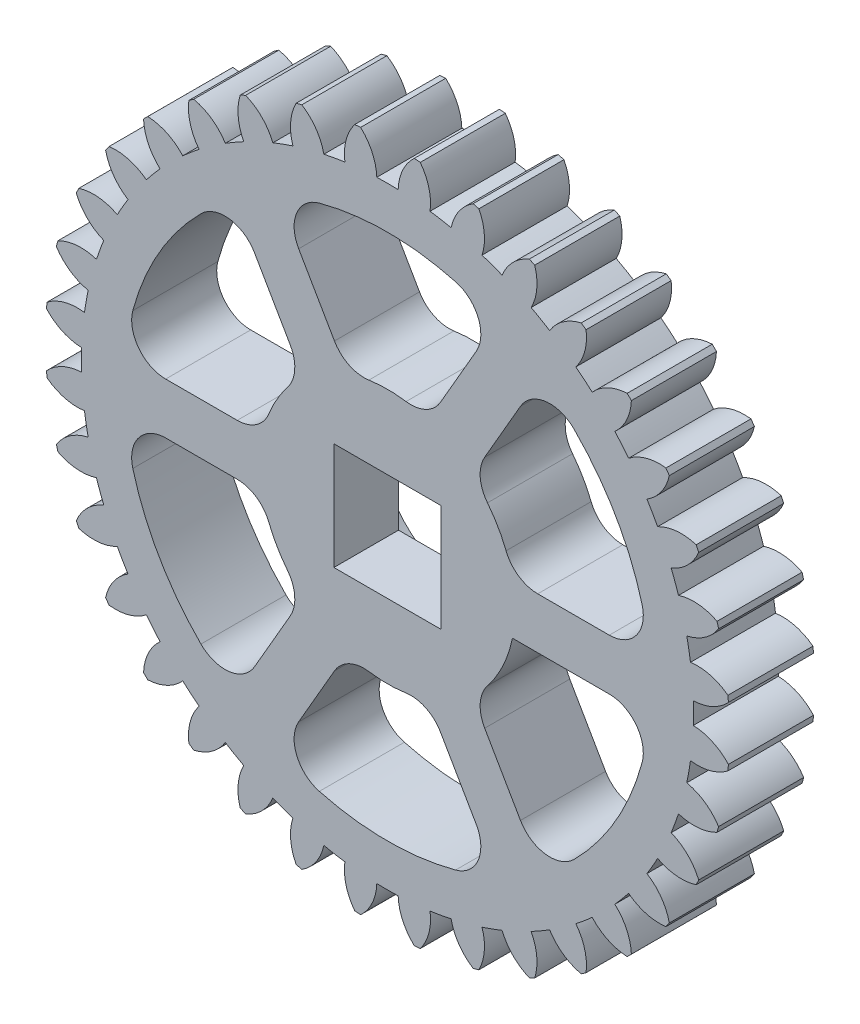
from build123d import *

# Parameters (mm, degrees)
BOSS_EXTRUDE1_DEPTH = 5
SKETCH2_W           = 6.3
SKETCH2_H           = 6.3
CUT_EXTRUDE1_DEPTH  = 5
SKETCH2_3_R         = 5.5
SKETCH2_3_W         = 6.3
SKETCH2_3_H         = 6.3
CUT_EXTRUDE2_DEPTH  = 1.2
CUT_EXTRUDE3_REACH  = 30.781
FILLET1_R           = 2


with BuildPart() as part:
    # Sketch1 → Boss-Extrude1 (new body)
    with BuildSketch(Plane.XY):
        with BuildLine():
            ThreePointArc((-19.372922994, 5.372587037), (-19.419069404, 5.203323965), (-19.463736977, 5.03366464))
            ThreePointArc((-19.463736977, 5.03366464), (-18.658088573, 4.199038956), (-17.592962747, 3.739499671))
            ThreePointArc((-17.592962747, 3.739499671), (-17.712752246, 3.123236124), (-17.810961484, 2.503167394))
            ThreePointArc((-17.810961484, 2.503167394), (-18.969024056, 2.435636207), (-20.011544712, 1.926892593))
            ThreePointArc((-20.011544712, 1.926892593), (-20.02759783, 1.752187768), (-20.042125769, 1.577349506))
            ThreePointArc((-20.042125769, 1.577349506), (-19.103785746, 0.89530304), (-17.975043415, 0.627702348))
            ThreePointArc((-17.975043415, 0.627702348), (-17.983260645, 0.313898982), (-17.986, 0))
            ThreePointArc((-17.986, 0), (-17.983260645, -0.313898982), (-17.975043415, -0.627702348))
            ThreePointArc((-17.975043415, -0.627702348), (-19.103785746, -0.89530304), (-20.042125769, -1.577349506))
            ThreePointArc((-20.042125769, -1.577349506), (-20.02759783, -1.752187768), (-20.011544712, -1.926892593))
            ThreePointArc((-20.011544712, -1.926892593), (-18.969024056, -2.435636207), (-17.810961484, -2.503167394))
            ThreePointArc((-17.810961484, -2.503167394), (-17.712752246, -3.123236124), (-17.592962747, -3.739499671))
            ThreePointArc((-17.592962747, -3.739499671), (-18.658088573, -4.199038956), (-19.463736977, -5.03366464))
            ThreePointArc((-19.463736977, -5.03366464), (-19.419069404, -5.203323965), (-19.372922994, -5.372587037))
            ThreePointArc((-19.372922994, -5.372587037), (-18.257898169, -5.692569879), (-17.105702502, -5.557979661))
            ThreePointArc((-17.105702502, -5.557979661), (-16.901311477, -6.151574298), (-16.676328808, -6.737674189))
            ThreePointArc((-16.676328808, -6.737674189), (-17.645474821, -7.375189199), (-18.293952386, -8.33703442))
            ThreePointArc((-18.293952386, -8.33703442), (-18.220502381, -8.496359796), (-18.145664815, -8.655038141))
            ThreePointArc((-18.145664815, -8.655038141), (-16.992015285, -8.776537697), (-15.880695405, -8.443915528))
            ThreePointArc((-15.880695405, -8.443915528), (-15.576332912, -8.993), (-15.252993057, -9.531127886))
            ThreePointArc((-15.252993057, -9.531127886), (-16.096712245, -10.32724805), (-16.568315309, -11.387087628))
            ThreePointArc((-16.568315309, -11.387087628), (-16.468314614, -11.531238034), (-16.367059793, -11.674510292))
            ThreePointArc((-16.367059793, -11.674510292), (-15.209838614, -11.593834857), (-14.173161414, -11.073287295))
            ThreePointArc((-14.173161414, -11.073287295), (-13.778075354, -11.561177948), (-13.366202831, -12.034983086))
            ThreePointArc((-13.366202831, -12.034983086), (-14.058859213, -12.965518694), (-14.339258355, -14.09114994))
            ThreePointArc((-14.339258355, -14.09114994), (-14.21574544, -14.21574544), (-14.09114994, -14.339258355))
            ThreePointArc((-14.09114994, -14.339258355), (-12.965518694, -14.058859213), (-12.034983086, -13.366202831))
            ThreePointArc((-12.034983086, -13.366202831), (-11.561177948, -13.778075354), (-11.073287295, -14.173161414))
            ThreePointArc((-11.073287295, -14.173161414), (-11.538005499, -15.029065872), (-11.698749958, -15.989636883))
            ThreePointArc((-11.698749958, -15.989636883), (-11.692683805, -16.17873713), (-11.674510292, -16.367059793))
            ThreePointArc((-11.674510292, -16.367059793), (-11.531238034, -16.468314614), (-11.387087628, -16.568315309))
            ThreePointArc((-11.387087628, -16.568315309), (-10.32724805, -16.096712245), (-9.531127886, -15.252993057))
            ThreePointArc((-9.531127886, -15.252993057), (-8.993, -15.576332912), (-8.443915528, -15.880695405))
            ThreePointArc((-8.443915528, -15.880695405), (-8.701631413, -16.552068237), (-8.789272246, -17.265845542))
            ThreePointArc((-8.789272246, -17.265845542), (-8.755520669, -17.710845752), (-8.655038141, -18.145664815))
            ThreePointArc((-8.655038141, -18.145664815), (-8.496359796, -18.220502381), (-8.33703442, -18.293952386))
            ThreePointArc((-8.33703442, -18.293952386), (-7.375189199, -17.645474821), (-6.737674189, -16.676328808))
            ThreePointArc((-6.737674189, -16.676328808), (-6.151574298, -16.901311477), (-5.557979661, -17.105702502))
            ThreePointArc((-5.557979661, -17.105702502), (-5.666059852, -17.555888899), (-5.702384729, -18.017440222))
            ThreePointArc((-5.702384729, -18.017440222), (-5.618749929, -18.714953674), (-5.372587037, -19.372922994))
            ThreePointArc((-5.372587037, -19.372922994), (-5.203323965, -19.419069404), (-5.03366464, -19.463736977))
            ThreePointArc((-5.03366464, -19.463736977), (-4.199038956, -18.658088573), (-3.739499671, -17.592962747))
            ThreePointArc((-3.739499671, -17.592962747), (-3.123236124, -17.712752246), (-2.503167394, -17.810961484))
            ThreePointArc((-2.503167394, -17.810961484), (-2.524693788, -18.015771442), (-2.531880924, -18.221584097))
            ThreePointArc((-2.531880924, -18.221584097), (-2.376544742, -19.166302294), (-1.926892593, -20.011544712))
            ThreePointArc((-1.926892593, -20.011544712), (-1.752187768, -20.02759783), (-1.577349506, -20.042125769))
            ThreePointArc((-1.577349506, -20.042125769), (-0.89530304, -19.103785746), (-0.627702348, -17.975043415))
            ThreePointArc((-0.627702348, -17.975043415), (0, -17.986), (0.627702348, -17.975043415))
            ThreePointArc((0.627702348, -17.975043415), (0.89530304, -19.103785746), (1.577349506, -20.042125769))
            ThreePointArc((1.577349506, -20.042125769), (1.752187768, -20.02759783), (1.926892593, -20.011544712))
            ThreePointArc((1.926892593, -20.011544712), (2.435636207, -18.969024056), (2.503167394, -17.810961484))
            ThreePointArc((2.503167394, -17.810961484), (3.123236124, -17.712752246), (3.739499671, -17.592962747))
            ThreePointArc((3.739499671, -17.592962747), (4.199038956, -18.658088573), (5.03366464, -19.463736977))
            ThreePointArc((5.03366464, -19.463736977), (5.203323965, -19.419069404), (5.372587037, -19.372922994))
            ThreePointArc((5.372587037, -19.372922994), (5.692569879, -18.257898169), (5.557979661, -17.105702502))
            ThreePointArc((5.557979661, -17.105702502), (6.151574298, -16.901311477), (6.737674189, -16.676328808))
            ThreePointArc((6.737674189, -16.676328808), (7.375189199, -17.645474821), (8.33703442, -18.293952386))
            ThreePointArc((8.33703442, -18.293952386), (8.496359796, -18.220502381), (8.655038141, -18.145664815))
            ThreePointArc((8.655038141, -18.145664815), (8.776537697, -16.992015285), (8.443915528, -15.880695405))
            ThreePointArc((8.443915528, -15.880695405), (8.993, -15.576332912), (9.531127886, -15.252993057))
            ThreePointArc((9.531127886, -15.252993057), (10.32724805, -16.096712245), (11.387087628, -16.568315309))
            ThreePointArc((11.387087628, -16.568315309), (11.531238034, -16.468314614), (11.674510292, -16.367059793))
            ThreePointArc((11.674510292, -16.367059793), (11.593834857, -15.209838614), (11.073287295, -14.173161414))
            ThreePointArc((11.073287295, -14.173161414), (11.561177948, -13.778075354), (12.034983086, -13.366202831))
            ThreePointArc((12.034983086, -13.366202831), (12.965518694, -14.058859213), (14.09114994, -14.339258355))
            ThreePointArc((14.09114994, -14.339258355), (14.21574544, -14.21574544), (14.339258355, -14.09114994))
            ThreePointArc((14.339258355, -14.09114994), (14.058859213, -12.965518694), (13.366202831, -12.034983086))
            ThreePointArc((13.366202831, -12.034983086), (13.778075354, -11.561177948), (14.173161414, -11.073287295))
            ThreePointArc((14.173161414, -11.073287295), (15.209838614, -11.593834857), (16.367059793, -11.674510292))
            ThreePointArc((16.367059793, -11.674510292), (16.468314614, -11.531238034), (16.568315309, -11.387087628))
            ThreePointArc((16.568315309, -11.387087628), (16.096712245, -10.32724805), (15.252993057, -9.531127886))
            ThreePointArc((15.252993057, -9.531127886), (15.576332912, -8.993), (15.880695405, -8.443915528))
            ThreePointArc((15.880695405, -8.443915528), (16.992015285, -8.776537697), (18.145664815, -8.655038141))
            ThreePointArc((18.145664815, -8.655038141), (18.220502381, -8.496359796), (18.293952386, -8.33703442))
            ThreePointArc((18.293952386, -8.33703442), (17.645474821, -7.375189199), (16.676328808, -6.737674189))
            ThreePointArc((16.676328808, -6.737674189), (16.901311477, -6.151574298), (17.105702502, -5.557979661))
            ThreePointArc((17.105702502, -5.557979661), (18.257898169, -5.692569879), (19.372922994, -5.372587037))
            ThreePointArc((19.372922994, -5.372587037), (19.419069404, -5.203323965), (19.463736977, -5.03366464))
            ThreePointArc((19.463736977, -5.03366464), (18.658088573, -4.199038956), (17.592962747, -3.739499671))
            ThreePointArc((17.592962747, -3.739499671), (17.712752246, -3.123236124), (17.810961484, -2.503167394))
            ThreePointArc((17.810961484, -2.503167394), (18.969024056, -2.435636207), (20.011544712, -1.926892593))
            ThreePointArc((20.011544712, -1.926892593), (20.02759783, -1.752187768), (20.042125769, -1.577349506))
            ThreePointArc((20.042125769, -1.577349506), (19.103785746, -0.89530304), (17.975043415, -0.627702348))
            ThreePointArc((17.975043415, -0.627702348), (17.986, 0), (17.975043415, 0.627702348))
            ThreePointArc((17.975043415, 0.627702348), (19.103785746, 0.89530304), (20.042125769, 1.577349506))
            ThreePointArc((20.042125769, 1.577349506), (20.02759783, 1.752187768), (20.011544712, 1.926892593))
            ThreePointArc((20.011544712, 1.926892593), (18.969024056, 2.435636207), (17.810961484, 2.503167394))
            ThreePointArc((17.810961484, 2.503167394), (17.712752246, 3.123236124), (17.592962747, 3.739499671))
            ThreePointArc((17.592962747, 3.739499671), (18.658088573, 4.199038956), (19.463736977, 5.03366464))
            ThreePointArc((19.463736977, 5.03366464), (19.419069404, 5.203323965), (19.372922994, 5.372587037))
            ThreePointArc((19.372922994, 5.372587037), (18.257898169, 5.692569879), (17.105702502, 5.557979661))
            ThreePointArc((17.105702502, 5.557979661), (16.901311477, 6.151574298), (16.676328808, 6.737674189))
            ThreePointArc((16.676328808, 6.737674189), (17.645474821, 7.375189199), (18.293952386, 8.33703442))
            ThreePointArc((18.293952386, 8.33703442), (18.220502381, 8.496359796), (18.145664815, 8.655038141))
            ThreePointArc((18.145664815, 8.655038141), (16.992015285, 8.776537697), (15.880695405, 8.443915528))
            ThreePointArc((15.880695405, 8.443915528), (15.576332912, 8.993), (15.252993057, 9.531127886))
            ThreePointArc((15.252993057, 9.531127886), (16.096712245, 10.32724805), (16.568315309, 11.387087628))
            ThreePointArc((16.568315309, 11.387087628), (16.468314614, 11.531238034), (16.367059793, 11.674510292))
            ThreePointArc((16.367059793, 11.674510292), (15.209838614, 11.593834857), (14.173161414, 11.073287295))
            ThreePointArc((14.173161414, 11.073287295), (13.778075354, 11.561177948), (13.366202831, 12.034983086))
            ThreePointArc((13.366202831, 12.034983086), (14.058859213, 12.965518694), (14.339258355, 14.09114994))
            ThreePointArc((14.339258355, 14.09114994), (14.21574544, 14.21574544), (14.09114994, 14.339258355))
            ThreePointArc((14.09114994, 14.339258355), (12.965518694, 14.058859213), (12.034983086, 13.366202831))
            ThreePointArc((12.034983086, 13.366202831), (11.561177948, 13.778075354), (11.073287295, 14.173161414))
            ThreePointArc((11.073287295, 14.173161414), (11.593834857, 15.209838614), (11.674510292, 16.367059793))
            ThreePointArc((11.674510292, 16.367059793), (11.531238034, 16.468314614), (11.387087628, 16.568315309))
            ThreePointArc((11.387087628, 16.568315309), (10.32724805, 16.096712245), (9.531127886, 15.252993057))
            ThreePointArc((9.531127886, 15.252993057), (8.993, 15.576332912), (8.443915528, 15.880695405))
            ThreePointArc((8.443915528, 15.880695405), (8.776537697, 16.992015285), (8.655038141, 18.145664815))
            ThreePointArc((8.655038141, 18.145664815), (8.496359796, 18.220502381), (8.33703442, 18.293952386))
            ThreePointArc((8.33703442, 18.293952386), (7.375189199, 17.645474821), (6.737674189, 16.676328808))
            ThreePointArc((6.737674189, 16.676328808), (6.151574298, 16.901311477), (5.557979661, 17.105702502))
            ThreePointArc((5.557979661, 17.105702502), (5.692569879, 18.257898169), (5.372587037, 19.372922994))
            ThreePointArc((5.372587037, 19.372922994), (5.203323965, 19.419069404), (5.03366464, 19.463736977))
            ThreePointArc((5.03366464, 19.463736977), (4.199038956, 18.658088573), (3.739499671, 17.592962747))
            ThreePointArc((3.739499671, 17.592962747), (3.123236124, 17.712752246), (2.503167394, 17.810961484))
            ThreePointArc((2.503167394, 17.810961484), (2.435636207, 18.969024056), (1.926892593, 20.011544712))
            ThreePointArc((1.926892593, 20.011544712), (1.752187768, 20.02759783), (1.577349506, 20.042125769))
            ThreePointArc((1.577349506, 20.042125769), (0.89530304, 19.103785746), (0.627702348, 17.975043415))
            ThreePointArc((0.627702348, 17.975043415), (0, 17.986), (-0.627702348, 17.975043415))
            ThreePointArc((-0.627702348, 17.975043415), (-0.89530304, 19.103785746), (-1.577349506, 20.042125769))
            ThreePointArc((-1.577349506, 20.042125769), (-1.752187768, 20.02759783), (-1.926892593, 20.011544712))
            ThreePointArc((-1.926892593, 20.011544712), (-2.376544742, 19.166302294), (-2.531880924, 18.221584097))
            ThreePointArc((-2.531880924, 18.221584097), (-2.524693788, 18.015771442), (-2.503167394, 17.810961484))
            ThreePointArc((-2.503167394, 17.810961484), (-3.123236124, 17.712752246), (-3.739499671, 17.592962747))
            ThreePointArc((-3.739499671, 17.592962747), (-4.199038956, 18.658088573), (-5.03366464, 19.463736977))
            ThreePointArc((-5.03366464, 19.463736977), (-5.203323965, 19.419069404), (-5.372587037, 19.372922994))
            ThreePointArc((-5.372587037, 19.372922994), (-5.618749929, 18.714953674), (-5.702384729, 18.017440222))
            ThreePointArc((-5.702384729, 18.017440222), (-5.666059852, 17.555888899), (-5.557979661, 17.105702502))
            ThreePointArc((-5.557979661, 17.105702502), (-6.151574298, 16.901311477), (-6.737674189, 16.676328808))
            ThreePointArc((-6.737674189, 16.676328808), (-7.375189199, 17.645474821), (-8.33703442, 18.293952386))
            ThreePointArc((-8.33703442, 18.293952386), (-8.496359796, 18.220502381), (-8.655038141, 18.145664815))
            ThreePointArc((-8.655038141, 18.145664815), (-8.755520669, 17.710845752), (-8.789272246, 17.265845542))
            ThreePointArc((-8.789272246, 17.265845542), (-8.701631413, 16.552068237), (-8.443915528, 15.880695405))
            ThreePointArc((-8.443915528, 15.880695405), (-8.993, 15.576332912), (-9.531127886, 15.252993057))
            ThreePointArc((-9.531127886, 15.252993057), (-10.32724805, 16.096712245), (-11.387087628, 16.568315309))
            ThreePointArc((-11.387087628, 16.568315309), (-11.531238034, 16.468314614), (-11.674510292, 16.367059793))
            ThreePointArc((-11.674510292, 16.367059793), (-11.692683805, 16.17873713), (-11.698749958, 15.989636883))
            ThreePointArc((-11.698749958, 15.989636883), (-11.538005499, 15.029065872), (-11.073287295, 14.173161414))
            ThreePointArc((-11.073287295, 14.173161414), (-11.561177948, 13.778075354), (-12.034983086, 13.366202831))
            ThreePointArc((-12.034983086, 13.366202831), (-12.965518694, 14.058859213), (-14.09114994, 14.339258355))
            ThreePointArc((-14.09114994, 14.339258355), (-14.21574544, 14.21574544), (-14.339258355, 14.09114994))
            ThreePointArc((-14.339258355, 14.09114994), (-14.058859213, 12.965518694), (-13.366202831, 12.034983086))
            ThreePointArc((-13.366202831, 12.034983086), (-13.778075354, 11.561177948), (-14.173161414, 11.073287295))
            ThreePointArc((-14.173161414, 11.073287295), (-15.209838614, 11.593834857), (-16.367059793, 11.674510292))
            ThreePointArc((-16.367059793, 11.674510292), (-16.468314614, 11.531238034), (-16.568315309, 11.387087628))
            ThreePointArc((-16.568315309, 11.387087628), (-16.096712245, 10.32724805), (-15.252993057, 9.531127886))
            ThreePointArc((-15.252993057, 9.531127886), (-15.576332912, 8.993), (-15.880695405, 8.443915528))
            ThreePointArc((-15.880695405, 8.443915528), (-16.992015285, 8.776537697), (-18.145664815, 8.655038141))
            ThreePointArc((-18.145664815, 8.655038141), (-18.220502381, 8.496359796), (-18.293952386, 8.33703442))
            ThreePointArc((-18.293952386, 8.33703442), (-17.645474821, 7.375189199), (-16.676328808, 6.737674189))
            ThreePointArc((-16.676328808, 6.737674189), (-16.901311477, 6.151574298), (-17.105702502, 5.557979661))
            ThreePointArc((-17.105702502, 5.557979661), (-18.257898169, 5.692569879), (-19.372922994, 5.372587037))
        make_face()
    extrude(amount=BOSS_EXTRUDE1_DEPTH)

    # Sketch2 → Cut-Extrude1 (cut)
    with BuildSketch(Plane(origin=(0, 0, 0), x_dir=(-1, 0, 0), z_dir=(0, 0, -1))):
        Rectangle(SKETCH2_W, SKETCH2_H)
    extrude(amount=-CUT_EXTRUDE1_DEPTH, mode=Mode.SUBTRACT)

    # Sketch2<3> → Cut-Extrude2 (cut)
    with BuildSketch(Plane(origin=(0, 0, 0), x_dir=(-1, 0, 0), z_dir=(0, 0, -1))):
        Circle(SKETCH2_3_R)
        Rectangle(SKETCH2_3_W, SKETCH2_3_H, mode=Mode.SUBTRACT)
    extrude(amount=-CUT_EXTRUDE2_DEPTH, mode=Mode.SUBTRACT)

    # Sketch3 → Cut-Extrude3 (cut, up to next)
    with BuildSketch(Plane(origin=(0, 0, 0), x_dir=(-1, 0, 0), z_dir=(0, 0, -1)), mode=Mode.PRIVATE) as cut_extrude3_sk1:
        with BuildLine():
            Line((-15.427248621, 1.5), (-7.348469228, 1.5))
            ThreePointArc((-7.348469228, 1.5), (-6.495190528, 3.75), (-4.97327272, 5.613961031))
            Line((-4.97327272, 5.613961031), (-9.012662416, 12.610389216))
            ThreePointArc((-9.012662416, 12.610389216), (-13.423393759, 7.75), (-15.427248621, 1.5))
        make_face()
    cut_extrude3_tool1 = extrude(cut_extrude3_sk1.sketch, amount=-CUT_EXTRUDE3_REACH, mode=Mode.PRIVATE) & part.part
    # Sketch3 → Cut-Extrude3 (cut, up to next)
    with BuildSketch(Plane(origin=(0, 0, 0), x_dir=(-1, 0, 0), z_dir=(0, 0, -1)), mode=Mode.PRIVATE) as cut_extrude3_sk2:
        with BuildLine():
            ThreePointArc((-4.97327272, -5.613961031), (-6.495190528, -3.75), (-7.348469228, -1.5))
            Line((-7.348469228, -1.5), (-15.427248621, -1.5))
            ThreePointArc((-15.427248621, -1.5), (-13.423393759, -7.75), (-9.012662416, -12.610389216))
            Line((-9.012662416, -12.610389216), (-4.97327272, -5.613961031))
        make_face()
    cut_extrude3_tool2 = extrude(cut_extrude3_sk2.sketch, amount=-CUT_EXTRUDE3_REACH, mode=Mode.PRIVATE) & part.part
    # Sketch3 → Cut-Extrude3 (cut, up to next)
    with BuildSketch(Plane(origin=(0, 0, 0), x_dir=(-1, 0, 0), z_dir=(0, 0, -1)), mode=Mode.PRIVATE) as cut_extrude3_sk3:
        with BuildLine():
            Line((-6.414586205, 14.110389216), (-2.375196508, 7.113961031))
            ThreePointArc((-2.375196508, 7.113961031), (0, 7.5), (2.375196508, 7.113961031))
            Line((2.375196508, 7.113961031), (6.414586205, 14.110389216))
            ThreePointArc((6.414586205, 14.110389216), (0, 15.5), (-6.414586205, 14.110389216))
        make_face()
    cut_extrude3_tool3 = extrude(cut_extrude3_sk3.sketch, amount=-CUT_EXTRUDE3_REACH, mode=Mode.PRIVATE) & part.part
    # Sketch3 → Cut-Extrude3 (cut, up to next)
    with BuildSketch(Plane(origin=(0, 0, 0), x_dir=(-1, 0, 0), z_dir=(0, 0, -1)), mode=Mode.PRIVATE) as cut_extrude3_sk4:
        with BuildLine():
            ThreePointArc((2.375196508, -7.113961031), (0, -7.5), (-2.375196508, -7.113961031))
            Line((-2.375196508, -7.113961031), (-6.414586205, -14.110389216))
            ThreePointArc((-6.414586205, -14.110389216), (0, -15.5), (6.414586205, -14.110389216))
            Line((6.414586205, -14.110389216), (2.375196508, -7.113961031))
        make_face()
    cut_extrude3_tool4 = extrude(cut_extrude3_sk4.sketch, amount=-CUT_EXTRUDE3_REACH, mode=Mode.PRIVATE) & part.part
    # Sketch3 → Cut-Extrude3 (cut, up to next)
    with BuildSketch(Plane(origin=(0, 0, 0), x_dir=(-1, 0, 0), z_dir=(0, 0, -1)), mode=Mode.PRIVATE) as cut_extrude3_sk5:
        with BuildLine():
            Line((9.012662416, 12.610389216), (4.97327272, 5.613961031))
            ThreePointArc((4.97327272, 5.613961031), (6.495190528, 3.75), (7.348469228, 1.5))
            Line((7.348469228, 1.5), (15.427248621, 1.5))
            ThreePointArc((15.427248621, 1.5), (13.423393759, 7.75), (9.012662416, 12.610389216))
        make_face()
    cut_extrude3_tool5 = extrude(cut_extrude3_sk5.sketch, amount=-CUT_EXTRUDE3_REACH, mode=Mode.PRIVATE) & part.part
    # Sketch3 → Cut-Extrude3 (cut, up to next)
    with BuildSketch(Plane(origin=(0, 0, 0), x_dir=(-1, 0, 0), z_dir=(0, 0, -1)), mode=Mode.PRIVATE) as cut_extrude3_sk6:
        with BuildLine():
            ThreePointArc((7.348469228, -1.5), (6.495190528, -3.75), (4.97327272, -5.613961031))
            Line((4.97327272, -5.613961031), (9.012662416, -12.610389216))
            ThreePointArc((9.012662416, -12.610389216), (13.423393759, -7.75), (15.427248621, -1.5))
            Line((15.427248621, -1.5), (7.348469228, -1.5))
        make_face()
    cut_extrude3_tool6 = extrude(cut_extrude3_sk6.sketch, amount=-CUT_EXTRUDE3_REACH, mode=Mode.PRIVATE) & part.part
    add(cut_extrude3_tool1.solids().sort_by_distance((10.217722, 5.899205, 0))[0], mode=Mode.SUBTRACT)
    add(cut_extrude3_tool2.solids().sort_by_distance((10.217722, -5.899205, 0))[0], mode=Mode.SUBTRACT)
    add(cut_extrude3_tool3.solids().sort_by_distance((0, 11.798409, 0))[0], mode=Mode.SUBTRACT)
    add(cut_extrude3_tool4.solids().sort_by_distance((0, -11.798409, 0))[0], mode=Mode.SUBTRACT)
    add(cut_extrude3_tool5.solids().sort_by_distance((-10.217722, 5.899205, 0))[0], mode=Mode.SUBTRACT)
    add(cut_extrude3_tool6.solids().sort_by_distance((-10.217722, -5.899205, 0))[0], mode=Mode.SUBTRACT)

    # Fillet1
    fillet1_edges = [part.edges().sort_by_distance(p)[0] for p in [
        (15.427248621, -1.5, 2.5),
        (9.012662416, -12.610389216, 2.5),
        (4.97327272, -5.613961031, 2.5),
        (2.375196508, -7.113961031, 2.5),
        (6.414586205, -14.110389216, 2.5),
        (-6.414586205, -14.110389216, 2.5),
        (-2.375196508, -7.113961031, 2.5),
        (-4.97327272, -5.613961031, 2.5),
        (-9.012662416, -12.610389216, 2.5),
        (-15.427248621, -1.5, 2.5),
        (-7.348469228, -1.5, 2.5),
        (-7.348469228, 1.5, 2.5),
        (-15.427248621, 1.5, 2.5),
        (-9.012662416, 12.610389216, 2.5),
        (-4.97327272, 5.613961031, 2.5),
        (-6.414586205, 14.110389216, 2.5),
        (6.414586205, 14.110389216, 2.5),
        (2.375196508, 7.113961031, 2.5),
        (4.97327272, 5.613961031, 2.5),
        (7.348469228, 1.5, 2.5),
        (15.427248621, 1.5, 2.5),
        (9.012662416, 12.610389216, 2.5),
        (-2.375196508, 7.113961031, 2.5),
    ]]
    fillet(fillet1_edges, radius=FILLET1_R)


solid = part.part
